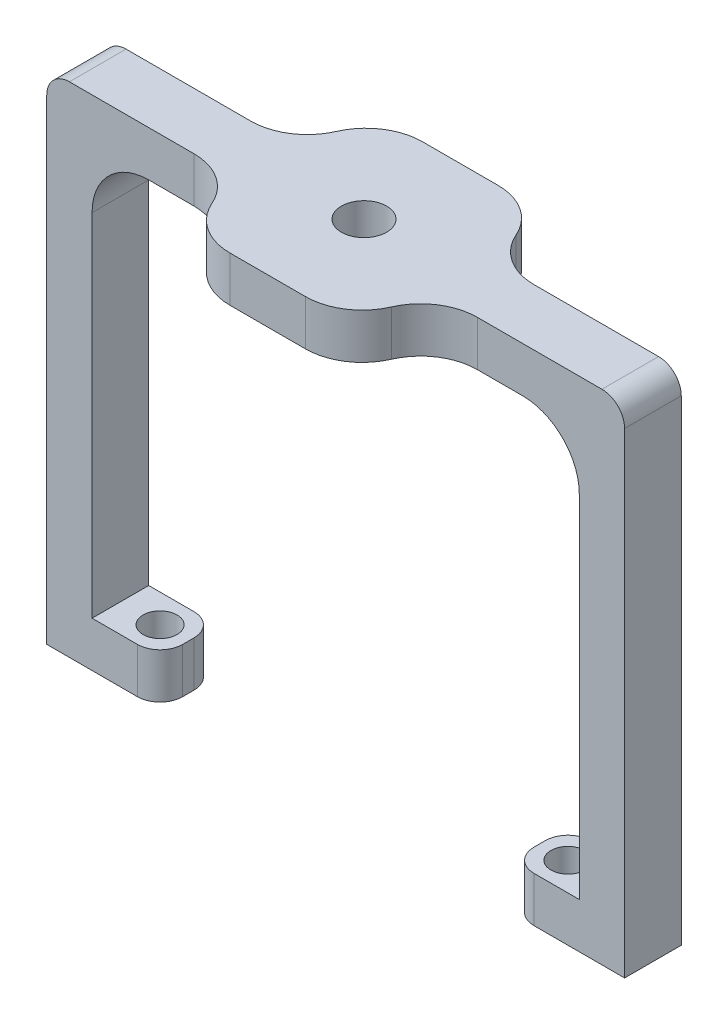
from build123d import *

# Parameters (mm, degrees)
SKETCH_1_W           = 10
SKETCH_1_H           = 5
EXTRUDE_1_DEPTH      = 4
SKETCH_3_R           = 1.5
CUT_EXTRUDE_1_DEPTH  = 4
SKETCH_4_W           = 4
SKETCH_4_H           = 5
EXTRUDE_2_DEPTH      = 40
SKETCH_5_W           = 5
SKETCH_5_H           = 4
EXTRUDE_3_DEPTH      = 47
SKETCH_7_W           = 4
SKETCH_7_H           = 5
EXTRUDE_4_DEPTH      = 40
SKETCH_8_W           = 5
SKETCH_8_H           = 4
EXTRUDE_5_DEPTH      = 6
SKETCH_10_R          = 1.5
CUT_EXTRUDE_2_DEPTH  = 6
EXTRUDE_6_DEPTH      = 6
EXTRUDE_6_DEPTH_BACK = 11
SKETCH_11_W          = 15
SKETCH_11_H          = 4
FILLET_1_R           = 5
SKETCH_12_R          = 2
CUT_EXTRUDE_3_DEPTH  = 6
FILLET_2_R           = 5
FILLET_3_R           = 5
FILLET_4_R           = 2
FILLET_5_R           = 2


with BuildPart() as part:
    # 草图1 → 凸台-拉伸1 (new body)
    with BuildSketch(Plane(origin=(0, 0, 0), x_dir=(1, 0, 0), z_dir=(0, 1, 0))):
        with Locations((5, -2.5)):
            Rectangle(SKETCH_1_W, SKETCH_1_H)
    extrude(amount=EXTRUDE_1_DEPTH)

    # 草图3 → 切除-拉伸1 (cut)
    with BuildSketch(Plane(origin=(0, 4, 0), x_dir=(1, 0, 0), z_dir=(0, 1, 0))):
        with Locations(Location((7.5, -2.5, 0), (0, 0, 270))):
            Circle(SKETCH_3_R)
    extrude(amount=-CUT_EXTRUDE_1_DEPTH, mode=Mode.SUBTRACT)

    # 草图4 → 凸台-拉伸2 (add)
    with BuildSketch(Plane(origin=(0, 4, 0), x_dir=(1, 0, 0), z_dir=(0, 1, 0))):
        with Locations((2, -2.5)):
            Rectangle(SKETCH_4_W, SKETCH_4_H)
    extrude(amount=EXTRUDE_2_DEPTH)

    # 草图5 → 凸台-拉伸3 (add)
    with BuildSketch(Plane(origin=(4, 0, 0), x_dir=(0, 0, -1), z_dir=(1, 0, 0))):
        with Locations((-2.5, 42)):
            Rectangle(SKETCH_5_W, SKETCH_5_H)
    extrude(amount=EXTRUDE_3_DEPTH)

    # 草图7 → 凸台-拉伸4 (add)
    with BuildSketch(Plane(origin=(0, 40, 0), x_dir=(-1, 0, 0), z_dir=(0, -1, 0))):
        with Locations((-49, -2.5)):
            Rectangle(SKETCH_7_W, SKETCH_7_H)
    extrude(amount=EXTRUDE_4_DEPTH)

    # 草图8 → 凸台-拉伸5 (add)
    with BuildSketch(Plane.ZY.offset(-47)):
        with Locations((2.5, 2)):
            Rectangle(SKETCH_8_W, SKETCH_8_H)
    extrude(amount=EXTRUDE_5_DEPTH)

    # 草图10 → 切除-拉伸2 (cut)
    with BuildSketch(Plane(origin=(0, 0, 0), x_dir=(-1, 0, 0), z_dir=(0, -1, 0))):
        with Locations(Location((-43.5, -2.5, 0), (0, 0, 90))):
            Circle(SKETCH_10_R)
    extrude(amount=-CUT_EXTRUDE_2_DEPTH, mode=Mode.SUBTRACT)

    # 草图11 → 凸台-拉伸6 (add, two sides: drawn at the far end of the back side and taken through both)
    with BuildSketch(Plane(origin=(0, 0, 0), x_dir=(-1, 0, 0), z_dir=(0, 0, -1)).offset(-EXTRUDE_6_DEPTH_BACK)):
        with Locations((-25.5, 42)):
            Rectangle(SKETCH_11_W, SKETCH_11_H)
    extrude(amount=EXTRUDE_6_DEPTH + EXTRUDE_6_DEPTH_BACK)

    # 圆角1
    fillet_1_edges = [part.edges().sort_by_distance(p)[0] for p in [
        (33, 42, 5),
        (33, 42, 0),
        (18, 42, 5),
        (18, 42, 0),
    ]]
    fillet(fillet_1_edges, radius=FILLET_1_R)

    # 草图12 → 切除-拉伸3 (cut)
    with BuildSketch(Plane(origin=(0, 44, 0), x_dir=(1, 0, 0), z_dir=(0, 1, 0))):
        with Locations(Location((25.5, -2.5, 0), (0, 0, 270))):
            Circle(SKETCH_12_R)
    extrude(amount=-CUT_EXTRUDE_3_DEPTH, mode=Mode.SUBTRACT)

    # 圆角2
    fillet_2_edges = [part.edges().sort_by_distance(p)[0] for p in [
        (18, 42, -6),
        (33, 42, -6),
        (33, 42, 11),
        (18, 42, 11),
    ]]
    fillet(fillet_2_edges, radius=FILLET_2_R)

    # 圆角3
    fillet_3_edges = [part.edges().sort_by_distance(p)[0] for p in [
        (4, 40, 2.5),
        (47, 40, 2.5),
    ]]
    fillet(fillet_3_edges, radius=FILLET_3_R)

    # 圆角4
    fillet_4_edges = [part.edges().sort_by_distance(p)[0] for p in [
        (10, 2, 0),
        (10, 2, 5),
    ]]
    fillet(fillet_4_edges, radius=FILLET_4_R)

    # 圆角5
    fillet_5_edges = [part.edges().sort_by_distance(p)[0] for p in [
        (0, 44, 2.5),
        (51, 44, 2.5),
        (41, 2, 0),
        (41, 2, 5),
    ]]
    fillet(fillet_5_edges, radius=FILLET_5_R)


solid = part.part
